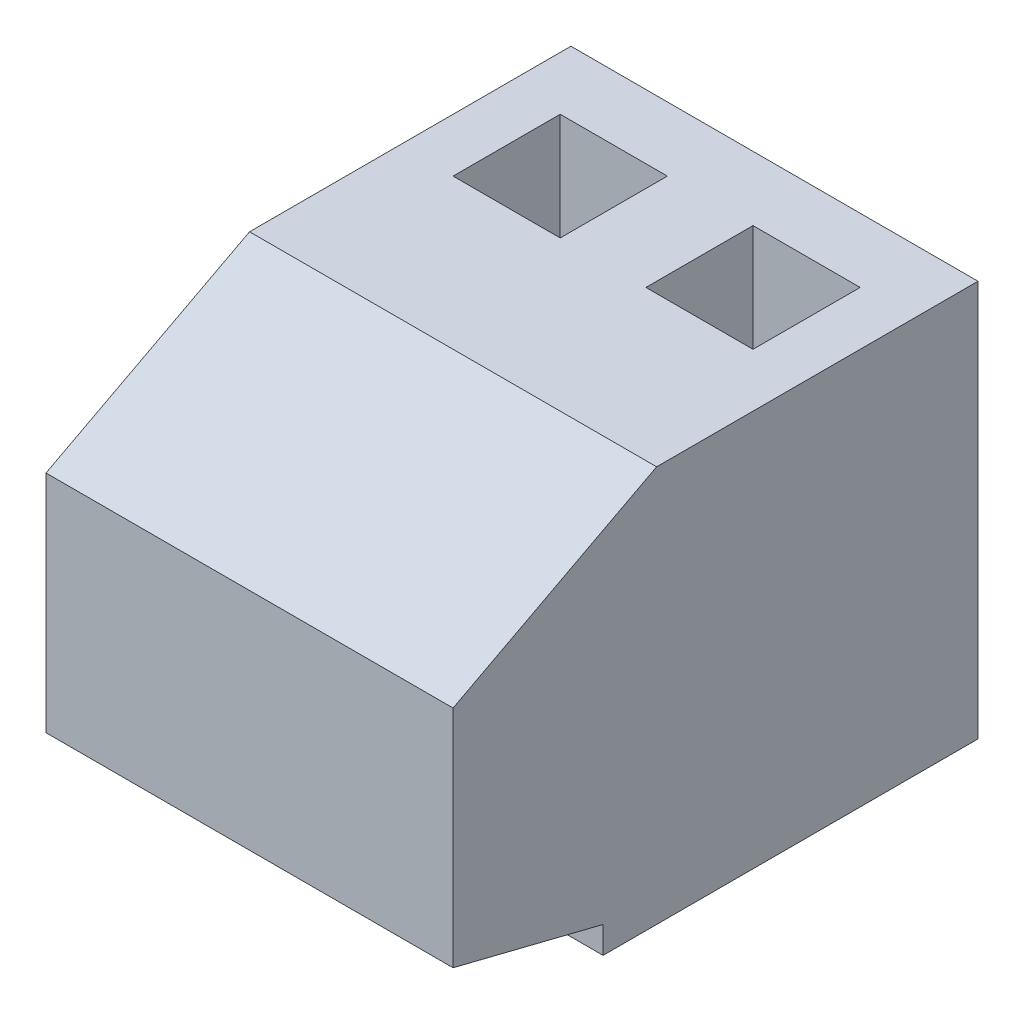
from build123d import *

# Parameters (mm, degrees)
SKETCH1_W           = 7.6
SKETCH1_H           = 7.4
BOSS_EXTRUDE1_DEPTH = 6
BOSS_EXTRUDE2_DEPTH = 7.6
SKETCH3_W           = 2
SKETCH3_H           = 2
CUT_EXTRUDE1_DEPTH  = 6


with BuildPart() as part:
    # Sketch1 → Boss-Extrude1 (new body)
    with BuildSketch(Plane.XY):
        Rectangle(SKETCH1_W, SKETCH1_H)
    extrude(amount=BOSS_EXTRUDE1_DEPTH)

    # Sketch2 → Boss-Extrude2 (add)
    with BuildSketch(Plane(origin=(3.8, 0, 0), x_dir=(0, 0, -1), z_dir=(1, 0, 0))):
        Polygon((-6, 3.7), (-6, -3.7), (-7, -3.7), (-7, -3.2), (-9.8, -2.5), (-9.8, 1.7), align=None)
    extrude(amount=-BOSS_EXTRUDE2_DEPTH)

    # Sketch3 → Cut-Extrude1 (cut)
    with BuildSketch(Plane(origin=(0, 3.7, 0), x_dir=(1, 0, 0), z_dir=(0, 1, 0))):
        with Locations((-1.8, -2.2)):
            Rectangle(SKETCH3_W, SKETCH3_H)
        with Locations((1.8, -2.2)):
            Rectangle(SKETCH3_W, SKETCH3_H)
    extrude(amount=-CUT_EXTRUDE1_DEPTH, mode=Mode.SUBTRACT)


solid = part.part
